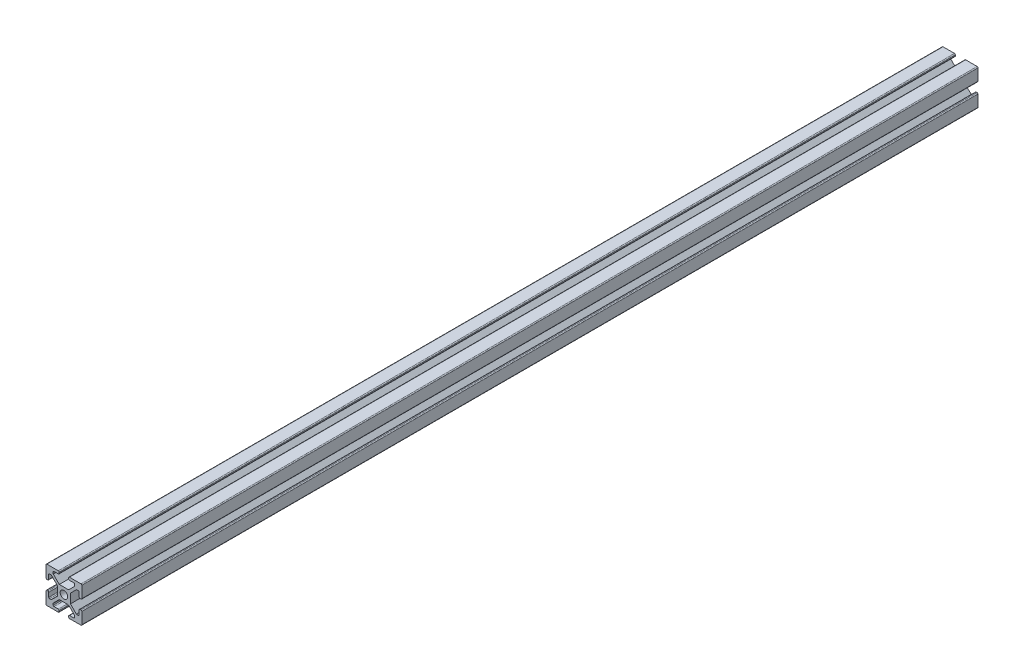
from build123d import *

# Parameters (mm, degrees)
BOSS_EXTRUDE1_DEPTH      = 250
FILLET1_R                = 0.5
CIRPATTERN3_COUNT        = 4
FILLET1_OF_CIRPATTERN3_R = 0.5
SKETCH3_R                = 2.095
CUT_EXTRUDE1_DEPTH       = 501.199960016


with BuildPart() as part:
    # Sketch2 → Boss-Extrude1 (new, symmetric)
    with BuildSketch(Plane.XY):
        Polygon((0, 3.66), (2.599339828, 3.66), (5.995, 7.055660172), (5.995, 8.5), (2.63, 8.5), (2.63, 10), (10, 10), (10, 2.63), (8.5, 2.63), (8.5, 5.995), (7.055660172, 5.995), (3.66, 2.599339828), (3.66, 0), (0, 0), align=None)
    boss_extrude1 = extrude(amount=BOSS_EXTRUDE1_DEPTH, both=True)

    # Fillet1
    fillet1_edges = [part.edges().sort_by_distance(p)[0] for p in [
        (5.995, 7.055660172, 0),
        (5.995, 8.5, 0),
        (2.63, 8.5, 0),
        (2.63, 10, 0),
        (10, 10, 0),
        (10, 2.63, 0),
        (8.5, 2.63, 0),
        (8.5, 5.995, 0),
        (7.055660172, 5.995, 0),
    ]]
    fillet(fillet1_edges, radius=FILLET1_R)

    # CirPattern3: Boss-Extrude1 ×4 about axis
    cirpattern3_axis = Axis((0, 0, 250), (0, 0, -1))
    for i in range(1, CIRPATTERN3_COUNT):
        add(boss_extrude1.rotate(cirpattern3_axis, i * 360 / CIRPATTERN3_COUNT))

    # Fillet1 of CirPattern3
    fillet1_of_cirpattern3_edges = [part.edges().sort_by_distance(p)[0] for p in [
        (7.055660172, -5.995, 0),
        (8.5, -5.995, 0),
        (8.5, -2.63, 0),
        (10, -2.63, 0),
        (10, -10, 0),
        (2.63, -10, 0),
        (2.63, -8.5, 0),
        (5.995, -8.5, 0),
        (5.995, -7.055660172, 0),
        (-5.995, -7.055660172, 0),
        (-5.995, -8.5, 0),
        (-2.63, -8.5, 0),
        (-2.63, -10, 0),
        (-10, -10, 0),
        (-10, -2.63, 0),
        (-8.5, -2.63, 0),
        (-8.5, -5.995, 0),
        (-7.055660172, -5.995, 0),
        (-7.055660172, 5.995, 0),
        (-8.5, 5.995, 0),
        (-8.5, 2.63, 0),
        (-10, 2.63, 0),
        (-10, 10, 0),
        (-2.63, 10, 0),
        (-2.63, 8.5, 0),
        (-5.995, 8.5, 0),
        (-5.995, 7.055660172, 0),
    ]]
    fillet(fillet1_of_cirpattern3_edges, radius=FILLET1_OF_CIRPATTERN3_R)

    # Sketch3 → Cut-Extrude1 (cut, through all)
    with BuildSketch(Plane.XY.offset(250)):
        Circle(SKETCH3_R)
    extrude(amount=-CUT_EXTRUDE1_DEPTH, mode=Mode.SUBTRACT)


solid = part.part
